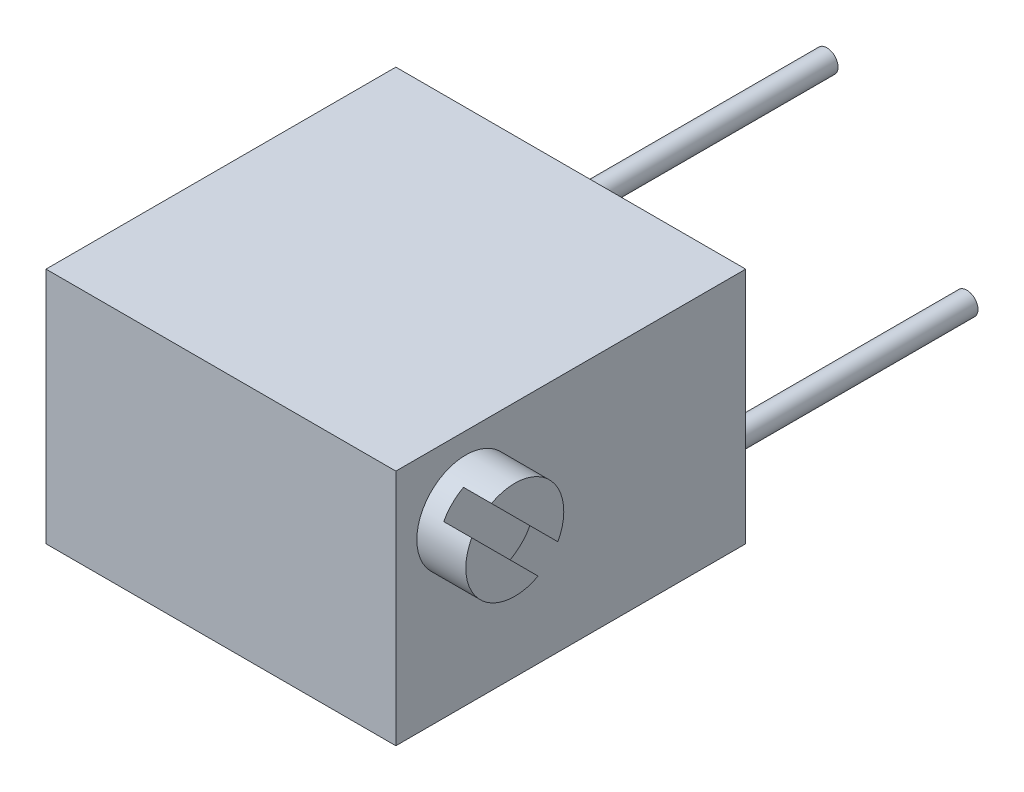
from build123d import *

# Parameters (mm, degrees)
SKETCH2_W           = 6.35
SKETCH2_H           = 4.318
BOSS_EXTRUDE1_DEPTH = 6.35
SKETCH3_R           = 0.889
BOSS_EXTRUDE2_DEPTH = 0.889
CUT_EXTRUDE1_START  = -0.508
CUT_EXTRUDE1_DEPTH  = 0.508
SKETCH8_R           = 0.2032
BOSS_EXTRUDE3_DEPTH = 4.7752


with BuildPart() as part:
    # Sketch2 → Boss-Extrude1 (new body)
    with BuildSketch(Plane.XY):
        with Locations((2.667, -1.143)):
            Rectangle(SKETCH2_W, SKETCH2_H)
    extrude(amount=BOSS_EXTRUDE1_DEPTH)

    # Sketch3 → Boss-Extrude2 (add)
    with BuildSketch(Plane(origin=(5.842, 0, 0), x_dir=(0, 0, -1), z_dir=(1, 0, 0))):
        with Locations(Location((-5.08, -0.254, 0), (0, 0, 180))):
            Circle(SKETCH3_R)
    extrude(amount=BOSS_EXTRUDE2_DEPTH)

    # Sketch4 → Cut-Extrude1 (cut)
    with BuildSketch(Plane(origin=(6.731, 0, 0), x_dir=(0, 0, -1), z_dir=(1, 0, 0)).offset(CUT_EXTRUDE1_START)):
        with BuildLine():
            Line((-4.297980983, -0.676808772), (-5.502808772, 0.528019017))
            ThreePointArc((-5.502808772, 0.528019017), (-5.708617928, 0.374617928), (-5.862019017, 0.168808772))
            Line((-5.862019017, 0.168808772), (-4.657191228, -1.036019017))
            ThreePointArc((-4.657191228, -1.036019017), (-4.451382072, -0.882617928), (-4.297980983, -0.676808772))
        make_face()
    extrude(amount=CUT_EXTRUDE1_DEPTH, mode=Mode.SUBTRACT)

    # Sketch8 → Boss-Extrude3 (add)
    with BuildSketch(Plane(origin=(0, 0, 0), x_dir=(-1, 0, 0), z_dir=(0, 0, -1))):
        with Locations(Location((0, -2.286, 0), (0, 0, 180))):
            Circle(SKETCH8_R)
        with Locations(Location((-5.08, -2.286, 0), (0, 0, 180))):
            Circle(SKETCH8_R)
        with Locations(Location((-2.54, 0.254, 0), (0, 0, 180))):
            Circle(SKETCH8_R)
    extrude(amount=BOSS_EXTRUDE3_DEPTH)


solid = part.part
